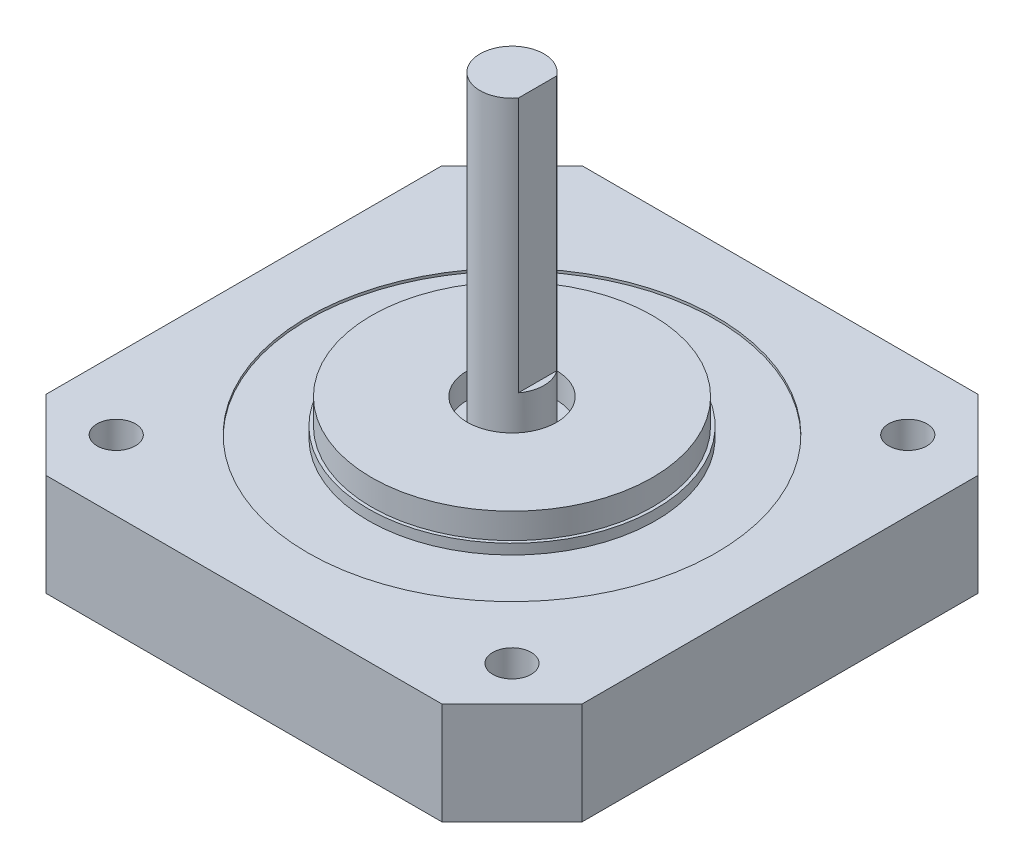
from build123d import *

# Parameters (mm, degrees)
SKETCH1_W           = 42
SKETCH1_H           = 42
NEMA_17_DEPTH       = 8
CHAMFER1_SIZE       = 5.5
SKETCH2_R           = 1.5
M3_BOLT_HOLES_DEPTH = 31.757112998
SKETCH3_R           = 16
CUT_EXTRUDE1_DEPTH  = 0.2
SKETCH4_R           = 11.25
BOSS_EXTRUDE1_DEPTH = 0.8
SKETCH5_R           = 11
BOSS_EXTRUDE2_DEPTH = 2
SKETCH6_R           = 3.5
CUT_EXTRUDE2_DEPTH  = 31.918602814
SKETCH7_R           = 2.5
BOSS_EXTRUDE3_DEPTH = 24
CUT_EXTRUDE3_START  = -20
CUT_EXTRUDE3_DEPTH  = 20
SKETCH10_R          = 1.5
BOSS_EXTRUDE4_DEPTH = 1


with BuildPart() as part:
    # Sketch1 → Nema 17 (new body)
    with BuildSketch(Plane(origin=(0, 0, 0), x_dir=(1, 0, 0), z_dir=(0, 1, 0))):
        Rectangle(SKETCH1_W, SKETCH1_H)
    extrude(amount=NEMA_17_DEPTH)

    # Chamfer1
    chamfer1_edges = [part.edges().sort_by_distance(p)[0] for p in [
        (21, 4, 21),
        (-21, 4, 21),
        (-21, 4, -21),
        (21, 4, -21),
    ]]
    chamfer(chamfer1_edges, length=CHAMFER1_SIZE)

    # Sketch2 → M3 Bolt Holes (cut, through all)
    with BuildSketch(Plane.XZ):
        with Locations(Location((-15.5, -15.5, 0), (0, 0, 270))):
            Circle(SKETCH2_R)
        with Locations(Location((15.5, -15.5, 0), (0, 0, 90))):
            Circle(SKETCH2_R)
        with Locations(Location((-15.5, 15.5, 0), (0, 0, 90))):
            Circle(SKETCH2_R)
        with Locations(Location((15.5, 15.5, 0), (0, 0, 270))):
            Circle(SKETCH2_R)
    extrude(amount=-M3_BOLT_HOLES_DEPTH, mode=Mode.SUBTRACT)

    # Sketch3 → Cut-Extrude1 (cut)
    with BuildSketch(Plane(origin=(0, 8, 0), x_dir=(1, 0, 0), z_dir=(0, 1, 0))):
        with Locations(Location((0, 0, 0), (0, 0, 270))):
            Circle(SKETCH3_R)
    extrude(amount=-CUT_EXTRUDE1_DEPTH, mode=Mode.SUBTRACT)

    # Sketch4 → Boss-Extrude1 (add)
    with BuildSketch(Plane(origin=(0, 7.8, 0), x_dir=(1, 0, 0), z_dir=(0, 1, 0))):
        with Locations(Location((0, 0, 0), (0, 0, 270))):
            Circle(SKETCH4_R)
    extrude(amount=BOSS_EXTRUDE1_DEPTH)

    # Sketch5 → Boss-Extrude2 (add)
    with BuildSketch(Plane(origin=(0, 8.6, 0), x_dir=(1, 0, 0), z_dir=(0, 1, 0))):
        with Locations(Location((0, 0, 0), (0, 0, 270))):
            Circle(SKETCH5_R)
    extrude(amount=BOSS_EXTRUDE2_DEPTH)

    # Sketch6 → Cut-Extrude2 (cut, through all)
    with BuildSketch(Plane(origin=(0, 8.6, 0), x_dir=(1, 0, 0), z_dir=(0, 1, 0))):
        with Locations(Location((0, 0, 0), (0, 0, 270))):
            Circle(SKETCH6_R)
    extrude(amount=CUT_EXTRUDE2_DEPTH, mode=Mode.SUBTRACT)

    # Sketch7 → Boss-Extrude3 (add)
    with BuildSketch(Plane(origin=(0, 8.6, 0), x_dir=(1, 0, 0), z_dir=(0, 1, 0))):
        with Locations(Location((0, 0, 0), (0, 0, 270))):
            Circle(SKETCH7_R)
    extrude(amount=BOSS_EXTRUDE3_DEPTH)

    # Sketch9 → Cut-Extrude3 (cut)
    with BuildSketch(Plane(origin=(0, 32.6, 0), x_dir=(1, 0, 0), z_dir=(0, 1, 0)).offset(CUT_EXTRUDE3_START)):
        with BuildLine():
            Line((2, 1.5), (2, -1.5))
            ThreePointArc((2, -1.5), (2.5, 0), (2, 1.5))
        make_face()
    extrude(amount=CUT_EXTRUDE3_DEPTH, mode=Mode.SUBTRACT)

    # Sketch10 → Boss-Extrude4 (add)
    with BuildSketch(Plane.XZ):
        with Locations(Location((15.5, 15.5, 0), (0, 0, 270))):
            Circle(SKETCH10_R)
        with Locations(Location((-15.5, -15.5, 0), (0, 0, 270))):
            Circle(SKETCH10_R)
        with Locations(Location((15.5, -15.5, 0), (0, 0, 270))):
            Circle(SKETCH10_R)
        with Locations(Location((-15.5, 15.5, 0), (0, 0, 270))):
            Circle(SKETCH10_R)
    extrude(amount=-BOSS_EXTRUDE4_DEPTH)


solid = part.part
